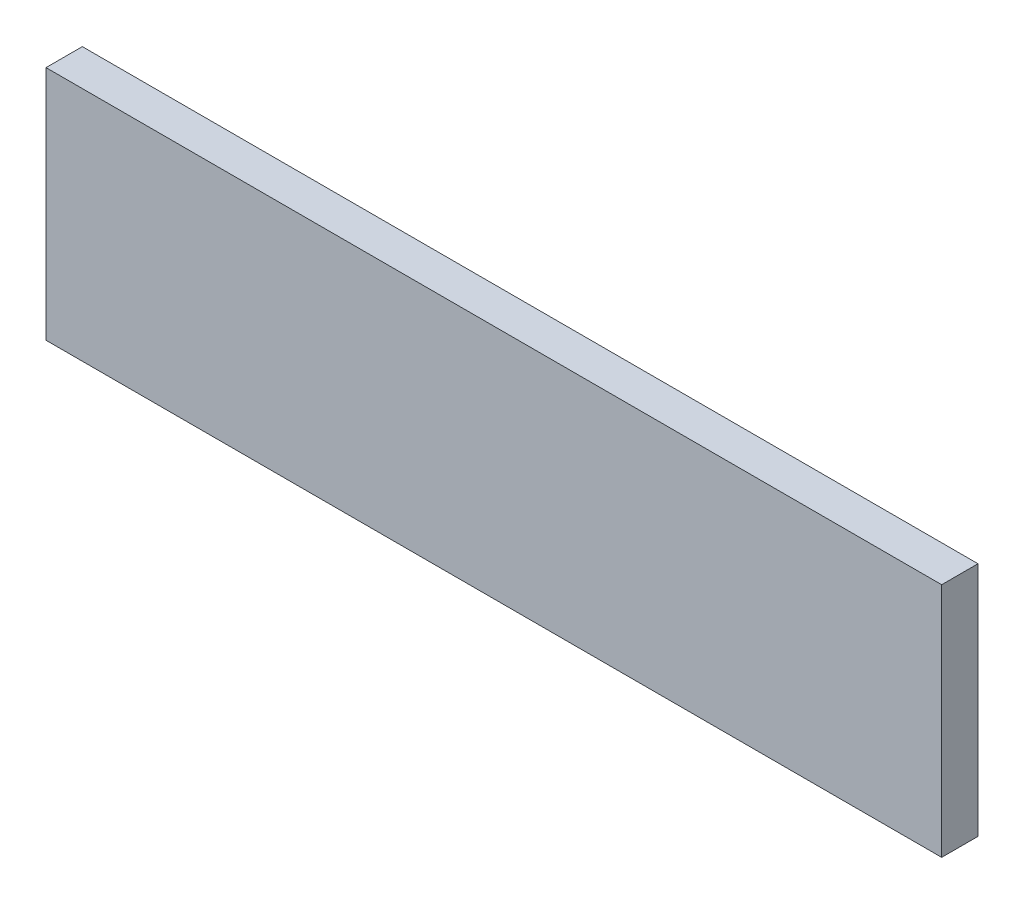
from build123d import *

# Parameters (mm, degrees)
ESQUISSE1_W        = 313.09999991
ESQUISSE1_H        = 82.55
BOSS_EXTRU_1_DEPTH = 12.7


with BuildPart() as part:
    # Esquisse1 → Boss.-Extru.1 (new body)
    with BuildSketch(Plane.XY):
        Rectangle(ESQUISSE1_W, ESQUISSE1_H)
    extrude(amount=BOSS_EXTRU_1_DEPTH)


solid = part.part
